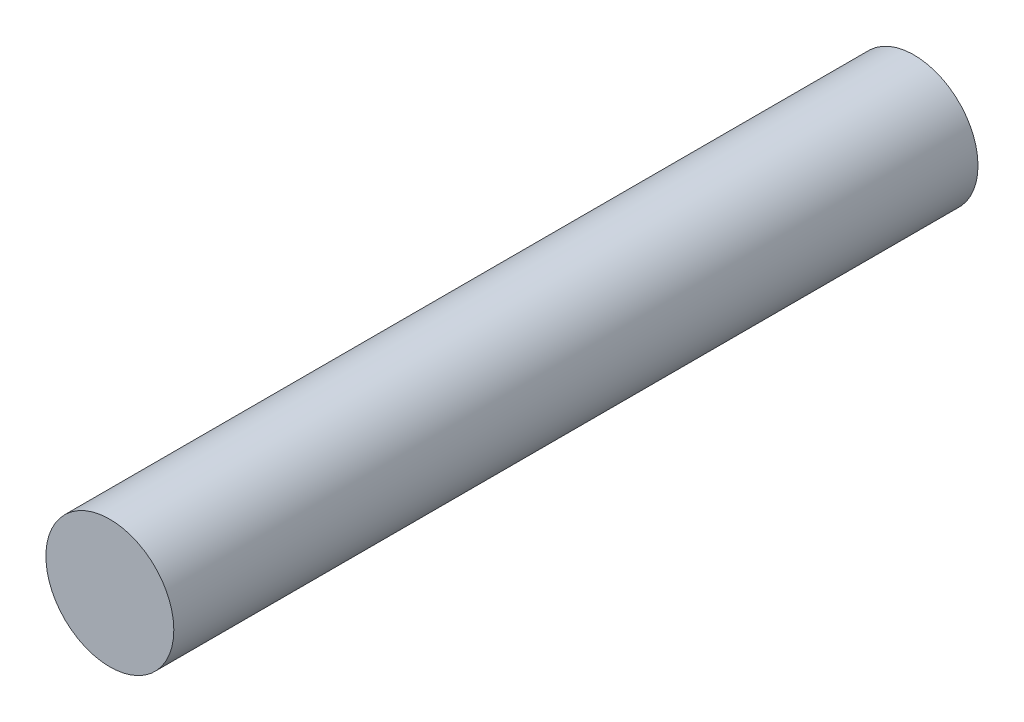
from build123d import *

# Parameters (mm, degrees)
SKETCH1_R           = 1.75
BOSS_EXTRUDE1_DEPTH = 22


with BuildPart() as part:
    # Sketch1 → Boss-Extrude1 (new body)
    with BuildSketch(Plane.XY):
        Circle(SKETCH1_R)
    extrude(amount=BOSS_EXTRUDE1_DEPTH)


solid = part.part
